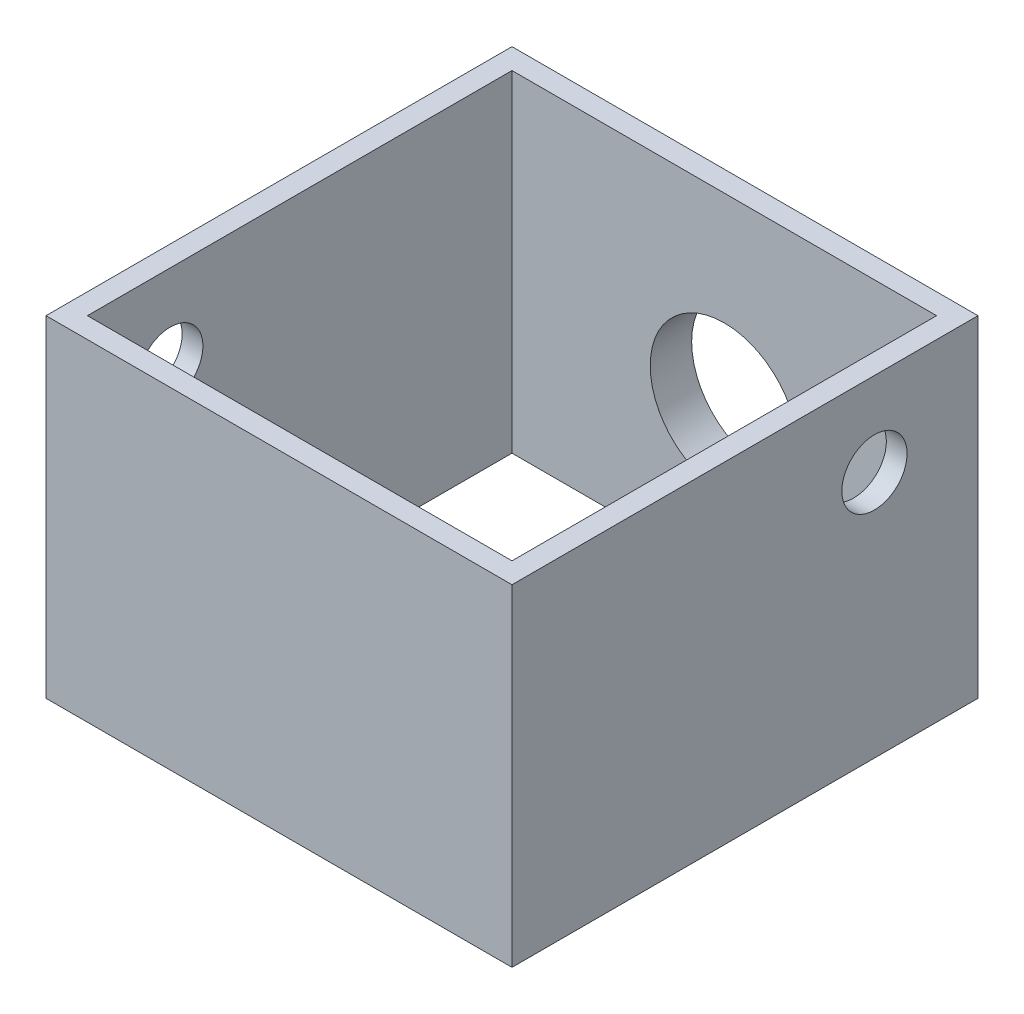
from build123d import *

# Parameters (mm, degrees)
SKETCH1_W           = 225
SKETCH1_H           = 225
SKETCH1_W_2         = 205
SKETCH1_H_2         = 205
WALLS_DEPTH         = 160
SKETCH1_5_W         = 205
SKETCH1_5_H         = 205
BOSS_EXTRUDE2_DEPTH = 7
SKETCH2_R           = 35.75
CUT_EXTRUDE1_DEPTH  = 197
BOSS_EXTRUDE3_START = 14
SKETCH6_R           = 50
SKETCH6_R_2         = 35.75
BOSS_EXTRUDE3_DEPTH = 14
BOSS_EXTRUDE4_START = 10
SKETCH7_R           = 50
SKETCH7_R_2         = 35.75
BOSS_EXTRUDE4_DEPTH = 10
SKETCH9_W           = 205
SKETCH9_H           = 205
CUT_EXTRUDE4_DEPTH  = 10
SKETCH10_R          = 15.75
CUT_EXTRUDE6_DEPTH  = 10
SKETCH11_R          = 15.75
CUT_EXTRUDE7_DEPTH  = 10


with BuildPart() as part:
    # Sketch1 → Walls (new body)
    with BuildSketch(Plane(origin=(0, 0, 0), x_dir=(1, 0, 0), z_dir=(0, 1, 0))):
        with Locations((-22.5, -12.5)):
            Rectangle(SKETCH1_W, SKETCH1_H)
        with Locations((-22.5, -12.5)):
            Rectangle(SKETCH1_W_2, SKETCH1_H_2, mode=Mode.SUBTRACT)
    extrude(amount=WALLS_DEPTH)

    # Sketch1<5> → Boss-Extrude2 (add)
    with BuildSketch(Plane(origin=(0, 0, 0), x_dir=(1, 0, 0), z_dir=(0, 1, 0))):
        with Locations((-22.5, -12.5)):
            Rectangle(SKETCH1_5_W, SKETCH1_5_H)
    extrude(amount=BOSS_EXTRUDE2_DEPTH)

    # Sketch2 → Cut-Extrude1 (cut)
    with BuildSketch(Plane(origin=(0, 0, -100), x_dir=(-1, 0, 0), z_dir=(0, 0, -1))):
        with Locations((22.5, 70)):
            Circle(SKETCH2_R)
    extrude(amount=-CUT_EXTRUDE1_DEPTH, mode=Mode.SUBTRACT)

    # Sketch6 → Boss-Extrude3 (add)
    with BuildSketch(Plane(origin=(0, 0, 115), x_dir=(-1, 0, 0), z_dir=(0, 0, -1)).offset(BOSS_EXTRUDE3_START)):
        with Locations((22.5, 70)):
            Circle(SKETCH6_R)
        with Locations((22.5, 70)):
            Circle(SKETCH6_R_2, mode=Mode.SUBTRACT)
    extrude(amount=-BOSS_EXTRUDE3_DEPTH)

    # Sketch7 → Boss-Extrude4 (add)
    with BuildSketch(Plane(origin=(0, 0, -100), x_dir=(-1, 0, 0), z_dir=(0, 0, -1)).offset(BOSS_EXTRUDE4_START)):
        with Locations((22.5, 70)):
            Circle(SKETCH7_R)
        with Locations((22.5, 70)):
            Circle(SKETCH7_R_2, mode=Mode.SUBTRACT)
    extrude(amount=-BOSS_EXTRUDE4_DEPTH)

    # Sketch9 → Cut-Extrude4 (cut)
    with BuildSketch(Plane(origin=(0, 7, 0), x_dir=(1, 0, 0), z_dir=(0, 1, 0))):
        with Locations((-22.5, -12.5)):
            Rectangle(SKETCH9_W, SKETCH9_H)
    extrude(amount=-CUT_EXTRUDE4_DEPTH, mode=Mode.SUBTRACT)

    # Sketch10 → Cut-Extrude6 (cut)
    with BuildSketch(Plane.ZY.offset(135)):
        with Locations((75, 119.5)):
            Circle(SKETCH10_R)
    extrude(amount=-CUT_EXTRUDE6_DEPTH, mode=Mode.SUBTRACT)

    # Sketch11 → Cut-Extrude7 (cut)
    with BuildSketch(Plane(origin=(90, 0, 0), x_dir=(0, 0, -1), z_dir=(1, 0, 0))):
        with Locations((50, 119.5)):
            Circle(SKETCH11_R)
    extrude(amount=-CUT_EXTRUDE7_DEPTH, mode=Mode.SUBTRACT)


solid = part.part
